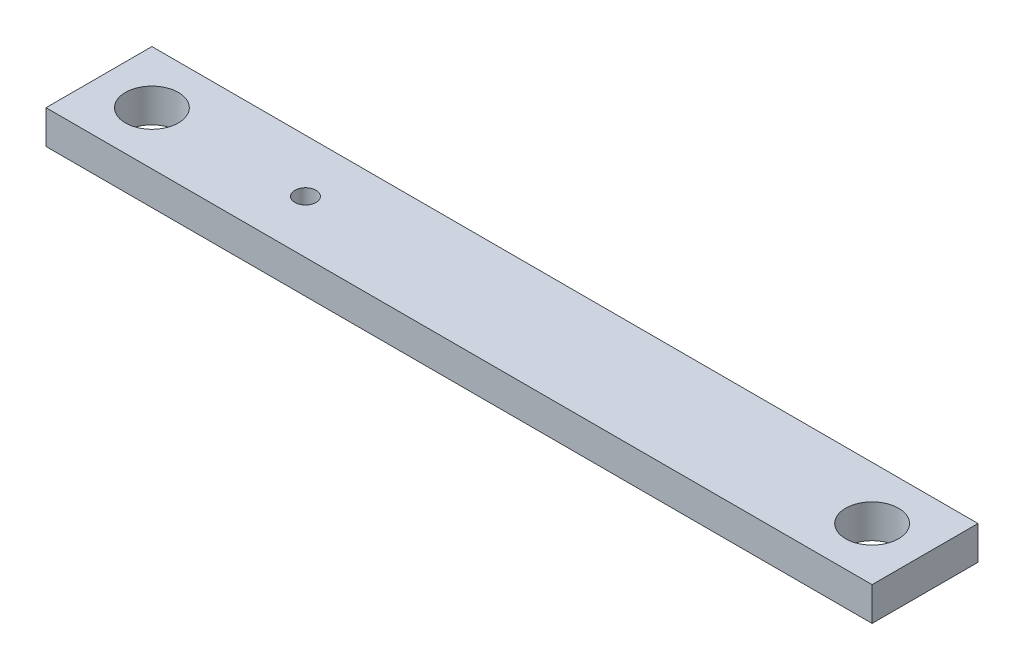
from build123d import *

# Parameters (mm, degrees)
SKETCH2_W           = 78
SKETCH2_H           = 10
BOSS_EXTRUDE1_DEPTH = 3.175
SKETCH3_R           = 2.5
CUT_EXTRUDE1_DEPTH  = 3.175
CUT_EXTRUDE2_REACH  = 41.447
SKETCH4_R           = 1


with BuildPart() as part:
    # Sketch2 → Boss-Extrude1 (new body)
    with BuildSketch(Plane(origin=(0, 0, 0), x_dir=(1, 0, 0), z_dir=(0, 1, 0))):
        Rectangle(SKETCH2_W, SKETCH2_H)
    extrude(amount=BOSS_EXTRUDE1_DEPTH)

    # Sketch3 → Cut-Extrude1 (cut)
    with BuildSketch(Plane(origin=(0, 3.175, 0), x_dir=(1, 0, 0), z_dir=(0, 1, 0))):
        with Locations(Location((-34, 0, 0), (0, 0, 270))):
            Circle(SKETCH3_R)
        with Locations(Location((34, 0, 0), (0, 0, 90))):
            Circle(SKETCH3_R)
    extrude(amount=-CUT_EXTRUDE1_DEPTH, mode=Mode.SUBTRACT)

    # Sketch4 → Cut-Extrude2 (cut, up to next)
    with BuildSketch(Plane(origin=(0, 3.175, 0), x_dir=(1, 0, 0), z_dir=(0, 1, 0)), mode=Mode.PRIVATE) as cut_extrude2_sk1:
        with Locations(Location((-19.5, 0, 0), (0, 0, 270))):
            Circle(SKETCH4_R)
    cut_extrude2_tool1 = extrude(cut_extrude2_sk1.sketch, amount=-CUT_EXTRUDE2_REACH, mode=Mode.PRIVATE) & part.part
    add(cut_extrude2_tool1.solids().sort_by_distance((-19.5, 3.175, 0))[0], mode=Mode.SUBTRACT)


solid = part.part
